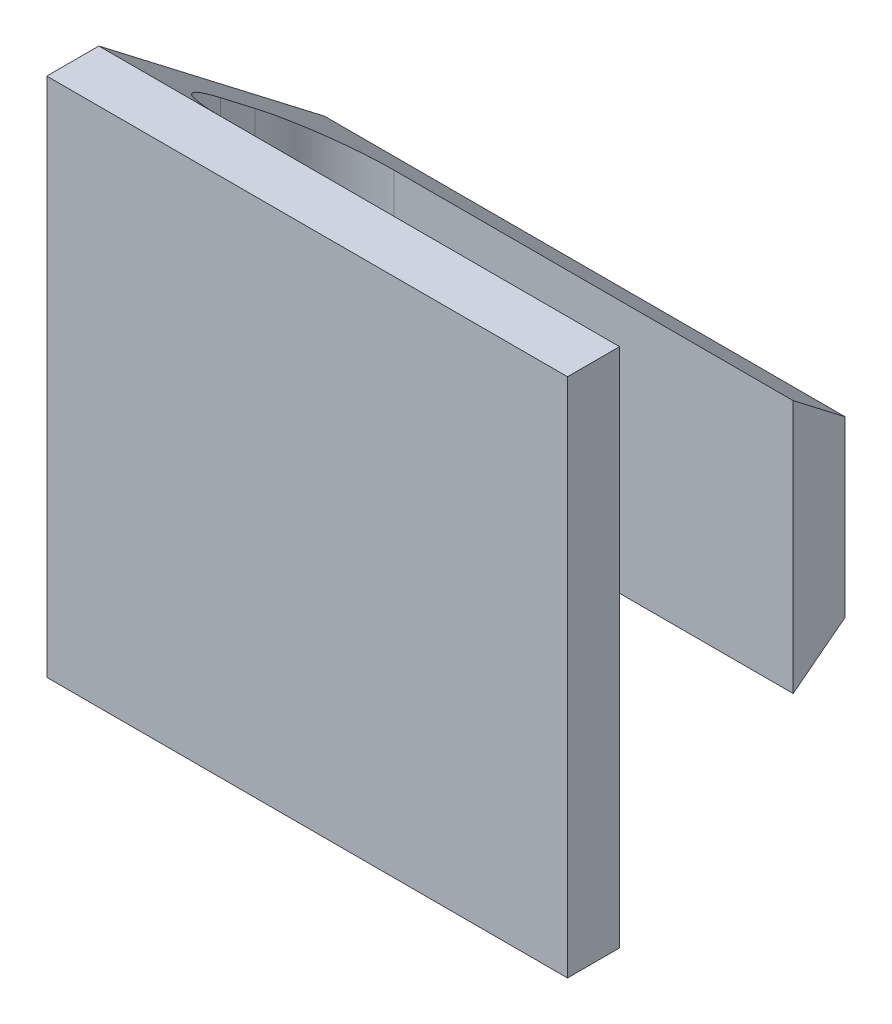
from build123d import *

# Parameters (mm, degrees)
BOSS_EXTRUDE1_DEPTH     = 15
CUT_EXTRUDE1_DEPTH      = 15
CUT_EXTRUDE1_DEPTH_BACK = 15


with BuildPart() as part:
    # Sketch1 → Boss-Extrude1 (new body)
    with BuildSketch(Plane(origin=(0, 0, 0), x_dir=(1, 0, 0), z_dir=(0, 1, 0))):
        with BuildLine():
            Line((-6.77549195, 3.313953488), (8.22450805, 3.313953488))
            Line((8.22450805, 3.313953488), (8.22450805, 1.813953488))
            Line((8.22450805, 1.813953488), (-3.27549195, 1.813953488))
            ThreePointArc((-3.27549195, 1.813953488), (-4.689705512, 1.228167051), (-5.27549195, -0.186046512))
            Line((-5.27549195, -0.186046512), (-5.27549195, -1.186046512))
            ThreePointArc((-5.27549195, -1.186046512), (-4.689705512, -2.600260074), (-3.27549195, -3.186046512))
            Line((-3.27549195, -3.186046512), (8.22450805, -3.186046512))
            Line((8.22450805, -3.186046512), (8.22450805, -4.686046512))
            Line((8.22450805, -4.686046512), (-6.77549195, -4.686046512))
            Line((-6.77549195, -4.686046512), (-6.77549195, -3.186046512))
            Line((-6.77549195, -3.186046512), (-6.77549195, 1.813953488))
            Line((-6.77549195, 1.813953488), (-6.77549195, 3.313953488))
        make_face()
    extrude(amount=BOSS_EXTRUDE1_DEPTH)

    # Sketch2 → Cut-Extrude1 (cut, two sides: drawn at the far end of the back side and taken through both)
    with BuildSketch(Plane(origin=(0, 0, 0), x_dir=(0, 0, -1), z_dir=(1, 0, 0)).offset(-CUT_EXTRUDE1_DEPTH_BACK)):
        Polygon((-3.186046512, 15), (3.313953488, 10), (3.313953488, 5), (-3.186046512, 0), (5.545494288, -1.974836629), (16.327123692, 9.034309621), (5.033464235, 17.721739972), align=None)
    extrude(amount=CUT_EXTRUDE1_DEPTH + CUT_EXTRUDE1_DEPTH_BACK, mode=Mode.SUBTRACT)


solid = part.part
